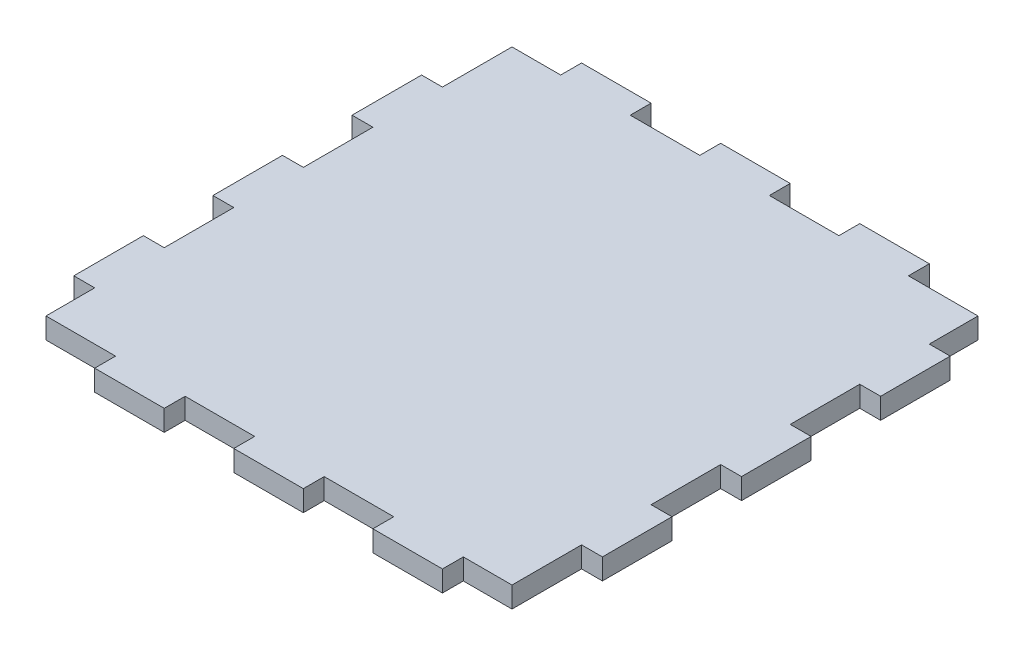
from build123d import *

# Parameters (mm, degrees)
SKETCH1_W           = 67
SKETCH1_H           = 67
SKETCH1_W_2         = 3
SKETCH1_H_2         = 10
SKETCH1_W_3         = 10
SKETCH1_H_3         = 3
BOSS_EXTRUDE1_DEPTH = 3
SKETCH3_W           = 6.460545278
SKETCH3_H           = 1.169767542
SKETCH3_W_2         = 7.74987154
SKETCH3_H_2         = 4.501562016
SKETCH3_W_3         = 6.14987154
SKETCH3_H_3         = 2.901562016
SKETCH3_R           = 11.812674278
SKETCH3_R_2         = 11.012674278
SKETCH3_R_3         = 8.532957956
SKETCH3_R_4         = 7.732957956
CUT_EXTRUDE1_DEPTH  = 0.3


with BuildPart() as part:
    # Sketch1 → Boss-Extrude1 (new body)
    with BuildSketch(Plane(origin=(0, 0, 0), x_dir=(1, 0, 0), z_dir=(0, 1, 0))):
        Rectangle(SKETCH1_W, SKETCH1_H)
        with Locations((-35, -21.5)):
            Rectangle(SKETCH1_W_2, SKETCH1_H_2)
        with Locations((-35, -1.5)):
            Rectangle(SKETCH1_W_2, SKETCH1_H_2)
        with Locations((-35, 18.5)):
            Rectangle(SKETCH1_W_2, SKETCH1_H_2)
        with Locations((-18.5, -35)):
            Rectangle(SKETCH1_W_3, SKETCH1_H_3)
        with Locations((1.5, -35)):
            Rectangle(SKETCH1_W_3, SKETCH1_H_3)
        with Locations((21.5, -35)):
            Rectangle(SKETCH1_W_3, SKETCH1_H_3)
        with Locations((35, -18.5)):
            Rectangle(SKETCH1_W_2, SKETCH1_H_2)
        with Locations((35, 1.5)):
            Rectangle(SKETCH1_W_2, SKETCH1_H_2)
        with Locations((35, 21.5)):
            Rectangle(SKETCH1_W_2, SKETCH1_H_2)
        with Locations((18.5, 35)):
            Rectangle(SKETCH1_W_3, SKETCH1_H_3)
        with Locations((-1.5, 35)):
            Rectangle(SKETCH1_W_3, SKETCH1_H_3)
        with Locations((-21.5, 35)):
            Rectangle(SKETCH1_W_3, SKETCH1_H_3)
    extrude(amount=BOSS_EXTRUDE1_DEPTH)

    # Sketch3 → Cut-Extrude1 (cut)
    # profile 1 of 5: a face of its own
    with BuildSketch(Plane.XZ):
        with BuildLine():
            Line((17.951474003, -11.996306148), (19.468912415, -11.996306148))
            ThreePointArc((19.468912415, -11.996306148), (21.873075471, -11.000469204), (22.868912415, -8.596306148))
            Line((22.868912415, -8.596306148), (22.868912415, 12.012813943))
            ThreePointArc((22.868912415, 12.012813943), (21.873075471, 14.416976999), (19.468912415, 15.412813943))
            Line((19.468912415, 15.412813943), (-19.75568403, 15.412813943))
            ThreePointArc((-19.75568403, 15.412813943), (-22.159847086, 14.416976999), (-23.15568403, 12.012813943))
            Line((-23.15568403, 12.012813943), (-23.15568403, -8.596306148))
            ThreePointArc((-23.15568403, -8.596306148), (-22.159847086, -11.000469204), (-19.75568403, -11.996306148))
            Line((-19.75568403, -11.996306148), (-7.131170101, -11.996306148))
            Line((-7.131170101, -11.996306148), (-6.58045367, -15.77368629))
            ThreePointArc((-6.58045367, -15.77368629), (-5.775436093, -17.242792), (-4.205560916, -17.827443017))
            Line((-4.205560916, -17.827443017), (4.072492002, -17.827443017))
            ThreePointArc((4.072492002, -17.827443017), (5.634337803, -17.249704715), (6.444235152, -15.794641095))
            Line((6.444235152, -15.794641095), (7.032301062, -11.996306148))
            Line((7.032301062, -11.996306148), (9.890928725, -11.996306148))
            Line((9.890928725, -11.996306148), (9.890928725, -13.96607369))
            Line((9.890928725, -13.96607369), (17.951474003, -13.96607369))
            Line((17.951474003, -13.96607369), (17.951474003, -11.996306148))
        make_face()
        with BuildLine():
            Line((-6.322712542, -11.996306148), (6.222769895, -11.996306148))
            Line((6.222769895, -11.996306148), (5.653654102, -15.672241736))
            ThreePointArc((5.653654102, -15.672241736), (5.113722536, -16.642284149), (4.072492002, -17.027443017))
            Line((4.072492002, -17.027443017), (-4.205560916, -17.027443017))
            ThreePointArc((-4.205560916, -17.027443017), (-5.252144367, -16.637675672), (-5.788822752, -15.658271866))
            Line((-5.788822752, -15.658271866), (-6.322712542, -11.996306148))
        make_face(mode=Mode.SUBTRACT)
        with Locations((13.921201364, -12.581189919)):
            Rectangle(SKETCH3_W, SKETCH3_H, mode=Mode.SUBTRACT)
        with BuildLine():
            ThreePointArc((22.068912415, -8.596306148), (21.307390046, -10.434783779), (19.468912415, -11.196306148))
            Line((19.468912415, -11.196306148), (-19.75568403, -11.196306148))
            ThreePointArc((-19.75568403, -11.196306148), (-21.594161661, -10.434783779), (-22.35568403, -8.596306148))
            Line((-22.35568403, -8.596306148), (-22.35568403, 12.012813943))
            ThreePointArc((-22.35568403, 12.012813943), (-21.594161661, 13.851291574), (-19.75568403, 14.612813943))
            Line((-19.75568403, 14.612813943), (19.468912415, 14.612813943))
            ThreePointArc((19.468912415, 14.612813943), (21.307390046, 13.851291574), (22.068912415, 12.012813943))
            Line((22.068912415, 12.012813943), (22.068912415, -8.596306148))
        make_face(mode=Mode.SUBTRACT)
    # profile 2 of 5: a face of its own
    with BuildSketch(Plane.XZ):
        with BuildLine():
            Line((-3.20545277, -15.827443017), (2.975704553, -15.827443017))
            add(Edge.make_bspline(
                [(2.953511817, -12.870475248), (3.156880299, -12.869857322), (3.585089851, -12.956102965), (4.018056229, -13.335311226), (4.232845726, -13.825946117), (4.282993557, -14.510967663), (4.056789396, -15.180852207), (3.536001149, -15.684997342), (3.16114062, -15.80680282), (2.975704553, -15.827443017)],
                knots=[0.000309469, 0.000309469, 0.000309469, 0.000309469, 0.126123229, 0.251936989, 0.37775075, 0.50356451, 0.75519203, 0.881005791, 1.006819551, 1.006819551, 1.006819551, 1.006819551], degree=3))
            Line((2.953511817, -12.870475248), (-3.208812782, -12.870477681))
            add(Edge.make_bspline(
                [(-3.20545277, -15.827443017), (-3.402440677, -15.796950089), (-3.804790668, -15.67436393), (-4.360046403, -15.161364486), (-4.548558911, -14.293381235), (-4.249990898, -13.494614941), (-3.796080691, -13.08166476), (-3.514079359, -12.94650227), (-3.330583264, -12.891839413), (-3.250572572, -12.877657517), (-3.208812782, -12.870477681)],
                knots=[-0.01081197, -0.01081197, -0.01081197, -0.01081197, 0.116511645, 0.24383526, 0.49848249, 0.75312972, 0.880453335, 0.944115143, 0.975946047, 1.00777695, 1.00777695, 1.00777695, 1.00777695], degree=3))
        make_face()
        with BuildLine():
            add(Edge.make_bspline(
                [(2.954312548, -13.670477681), (3.002162708, -13.670286106), (3.107702292, -13.680346372), (3.235248962, -13.726706918), (3.341954697, -13.812630756), (3.434286544, -13.998064842), (3.47500749, -14.35295522), (3.304919264, -14.84862877), (3.068019803, -15.006185035), (2.927947638, -15.027443017)],
                knots=[-0.000203812, -0.000203812, -0.000203812, -0.000203812, 0.061637445, 0.123478703, 0.247161218, 0.370843733, 0.494526248, 0.741891278, 0.989256308, 0.989256308, 0.989256308, 0.989256308], degree=3))
            Line((2.927947638, -15.027443017), (-3.141370514, -15.027443017))
            add(Edge.make_bspline(
                [(-3.141370514, -15.027443017), (-3.191002063, -15.018349114), (-3.295796079, -14.989541193), (-3.43833154, -14.916637531), (-3.558968521, -14.800275144), (-3.643853224, -14.612459797), (-3.674059975, -14.29626228), (-3.520794101, -13.870784083), (-3.275666554, -13.702096641), (-3.135980342, -13.670477681)],
                knots=[0.01613903, 0.01613903, 0.01613903, 0.01613903, 0.077002925, 0.137866819, 0.259594608, 0.381322398, 0.503050187, 0.746505765, 0.989961344, 0.989961344, 0.989961344, 0.989961344], degree=3))
            Line((-3.135980342, -13.670477681), (2.954312548, -13.670477681))
        make_face(mode=Mode.SUBTRACT)
    # profile 3 of 5: a face of its own
    with BuildSketch(Plane.XZ):
        with Locations((-16.962226762, -3.831057055)):
            Rectangle(SKETCH3_W_2, SKETCH3_H_2)
        with Locations((-16.962226762, -3.831057055)):
            Rectangle(SKETCH3_W_3, SKETCH3_H_3, mode=Mode.SUBTRACT)
    # profile 4 of 5: a face of its own
    with BuildSketch(Plane.XZ):
        with Locations(Location((-0.032284279, 1.802644777, 0), (0, 0, 270))):
            Circle(SKETCH3_R)
        with Locations(Location((-0.032284279, 1.802644777, 0), (0, 0, 270))):
            Circle(SKETCH3_R_2, mode=Mode.SUBTRACT)
    # profile 5 of 5: a face of its own
    with BuildSketch(Plane.XZ):
        with Locations(Location((-0.153217329, 1.801981193, 0), (0, 0, 270))):
            Circle(SKETCH3_R_3)
        with Locations(Location((-0.153217329, 1.801981193, 0), (0, 0, 270))):
            Circle(SKETCH3_R_4, mode=Mode.SUBTRACT)
    extrude(amount=-CUT_EXTRUDE1_DEPTH, mode=Mode.SUBTRACT)


solid = part.part
